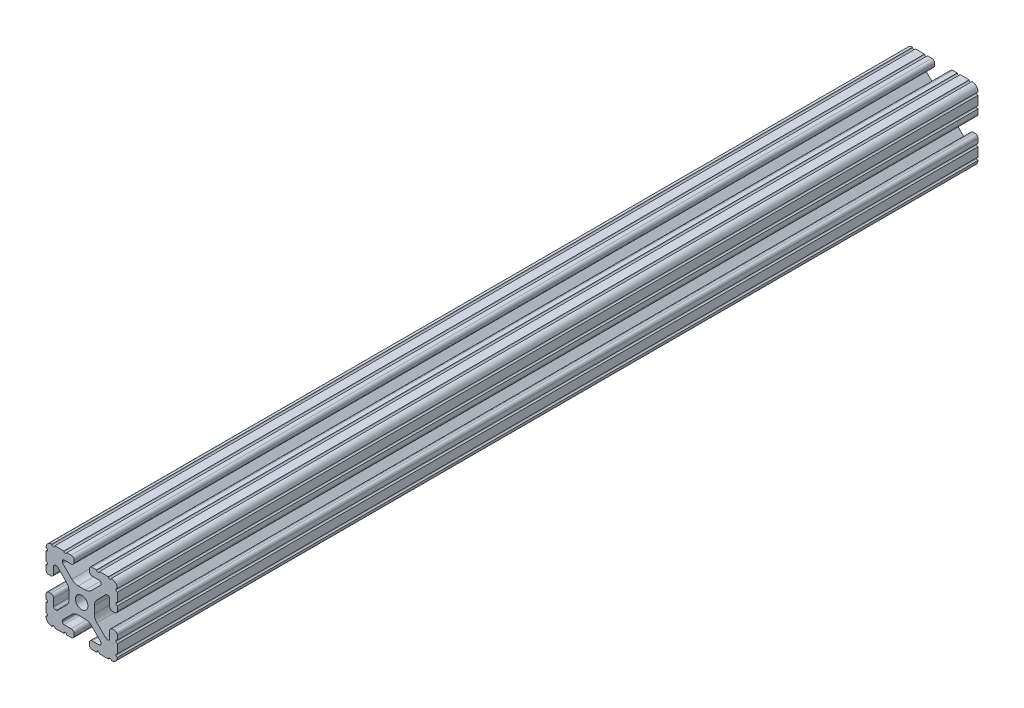
from build123d import *

# Parameters (mm, degrees)
SKETCH1_R      = 3.3274
EXTRUDE1_DEPTH = 459.74


with BuildPart() as part:
    # Sketch1 → Extrude1 (new body)
    with BuildSketch(Plane.XY):
        with BuildLine():
            Line((-10.022898969, 12.91475973), (-5.252158105, 8.144007132))
            ThreePointArc((-5.252158105, 8.144007132), (-3.715177372, 7.117027388), (-1.902183975, 6.7564))
            Line((-1.902183975, 6.7564), (1.902183975, 6.7564))
            ThreePointArc((1.902183975, 6.7564), (3.715177372, 7.117027388), (5.252158105, 8.144007132))
            Line((5.252158105, 8.144007132), (10.022898969, 12.91475973))
            ThreePointArc((10.022898969, 12.91475973), (10.218362387, 13.207291992), (10.287, 13.552357131))
            Line((10.287, 13.552357131), (10.287, 14.0843))
            ThreePointArc((10.287, 14.0843), (10.022898185, 14.721898185), (9.3853, 14.986))
            Line((9.3853, 14.986), (5.617617549, 14.986))
            ThreePointArc((5.617617549, 14.986), (4.519044045, 15.441044045), (4.064, 16.539617549))
            Line((4.064, 16.539617549), (4.064, 17.496382451))
            ThreePointArc((4.064, 17.496382451), (4.519044045, 18.594955955), (5.617617549, 19.05))
            Line((5.617617549, 19.05), (7.974178704, 19.05))
            ThreePointArc((7.974178704, 19.05), (8.736178704, 18.288), (9.498178704, 19.05))
            Line((9.498178704, 19.05), (14.327719207, 19.05))
            ThreePointArc((14.327719207, 19.05), (15.087603123, 18.231251131), (15.847487039, 19.05))
            ThreePointArc((15.847487039, 19.05), (18.120176289, 18.120192083), (19.05, 15.847509295))
            ThreePointArc((19.05, 15.847509295), (18.231250992, 15.08762539), (19.05, 14.327741484))
            Line((19.05, 14.327741484), (19.05, 9.496091471))
            ThreePointArc((19.05, 9.496091471), (18.231250992, 8.736207565), (19.05, 7.97632366))
            Line((19.05, 7.97632366), (19.05, 5.617617549))
            ThreePointArc((19.05, 5.617617549), (18.594955955, 4.519044045), (17.496382451, 4.064))
            Line((17.496382451, 4.064), (16.539617549, 4.064))
            ThreePointArc((16.539617549, 4.064), (15.441044045, 4.519044045), (14.986, 5.617617549))
            Line((14.986, 5.617617549), (14.986, 9.385342516))
            ThreePointArc((14.986, 9.385342516), (14.721898185, 10.022940701), (14.0843, 10.287042516))
            Line((14.0843, 10.287042516), (13.516042086, 10.287042516))
            ThreePointArc((13.516042086, 10.287042516), (13.170975923, 10.218404478), (12.878443117, 10.022939917))
            Line((12.878443117, 10.022939917), (8.14758008, 5.292065243))
            ThreePointArc((8.14758008, 5.292065243), (7.117955879, 3.751120653), (6.7564, 1.933453584))
            Line((6.7564, 1.933453584), (6.7564, -1.933453584))
            ThreePointArc((6.7564, -1.933453584), (7.117955879, -3.751120653), (8.14758008, -5.292065243))
            Line((8.14758008, -5.292065243), (12.878443117, -10.022939917))
            ThreePointArc((12.878443117, -10.022939917), (13.170975923, -10.218404478), (13.516042086, -10.287042516))
            Line((13.516042086, -10.287042516), (14.0843, -10.287042516))
            ThreePointArc((14.0843, -10.287042516), (14.721898185, -10.022940701), (14.986, -9.385342516))
            Line((14.986, -9.385342516), (14.986, -5.617617549))
            ThreePointArc((14.986, -5.617617549), (15.441044045, -4.519044045), (16.539617549, -4.064))
            Line((16.539617549, -4.064), (17.496382451, -4.064))
            ThreePointArc((17.496382451, -4.064), (18.594955955, -4.519044045), (19.05, -5.617617549))
            Line((19.05, -5.617617549), (19.05, -7.976318491))
            ThreePointArc((19.05, -7.976318491), (18.231250992, -8.736202396), (19.05, -9.496086302))
            Line((19.05, -9.496086302), (19.05, -14.32774291))
            ThreePointArc((19.05, -14.32774291), (18.231250992, -15.087626816), (19.05, -15.847510721))
            ThreePointArc((19.05, -15.847510721), (18.120175716, -18.120192644), (15.847486868, -19.05))
            ThreePointArc((15.847486868, -19.05), (15.087602952, -18.231251131), (14.327719036, -19.05))
            Line((14.327719036, -19.05), (9.496062448, -19.05))
            ThreePointArc((9.496062448, -19.05), (8.736178532, -18.231251131), (7.976294616, -19.05))
            Line((7.976294616, -19.05), (5.617617549, -19.05))
            ThreePointArc((5.617617549, -19.05), (4.519044045, -18.594955955), (4.064, -17.496382451))
            Line((4.064, -17.496382451), (4.064, -16.539617549))
            ThreePointArc((4.064, -16.539617549), (4.519044045, -15.441044045), (5.617617549, -14.986))
            Line((5.617617549, -14.986), (9.3853, -14.986))
            ThreePointArc((9.3853, -14.986), (10.022898185, -14.721898185), (10.287, -14.0843))
            Line((10.287, -14.0843), (10.287, -13.552357131))
            ThreePointArc((10.287, -13.552357131), (10.218362387, -13.207291992), (10.022898969, -12.91475973))
            Line((10.022898969, -12.91475973), (5.252158105, -8.144007132))
            ThreePointArc((5.252158105, -8.144007132), (3.715177372, -7.117027388), (1.902183975, -6.7564))
            Line((1.902183975, -6.7564), (-1.902183975, -6.7564))
            ThreePointArc((-1.902183975, -6.7564), (-3.715177372, -7.117027388), (-5.252158105, -8.144007132))
            Line((-5.252158105, -8.144007132), (-10.022898969, -12.91475973))
            ThreePointArc((-10.022898969, -12.91475973), (-10.218362387, -13.207291992), (-10.287, -13.552357131))
            Line((-10.287, -13.552357131), (-10.287, -14.0843))
            ThreePointArc((-10.287, -14.0843), (-10.022898185, -14.721898185), (-9.3853, -14.986))
            Line((-9.3853, -14.986), (-5.617617549, -14.986))
            ThreePointArc((-5.617617549, -14.986), (-4.519044045, -15.441044045), (-4.064, -16.539617549))
            Line((-4.064, -16.539617549), (-4.064, -17.496382451))
            ThreePointArc((-4.064, -17.496382451), (-4.519044045, -18.594955955), (-5.617617549, -19.05))
            Line((-5.617617549, -19.05), (-7.976294616, -19.05))
            ThreePointArc((-7.976294616, -19.05), (-8.736178532, -18.231251131), (-9.496062448, -19.05))
            Line((-9.496062448, -19.05), (-14.327719036, -19.05))
            ThreePointArc((-14.327719036, -19.05), (-15.087602952, -18.231251131), (-15.847486868, -19.05))
            ThreePointArc((-15.847486868, -19.05), (-18.120175716, -18.120192644), (-19.05, -15.847510721))
            ThreePointArc((-19.05, -15.847510721), (-18.231250992, -15.087626816), (-19.05, -14.32774291))
            Line((-19.05, -14.32774291), (-19.05, -9.496086302))
            ThreePointArc((-19.05, -9.496086302), (-18.231250992, -8.736202396), (-19.05, -7.976318491))
            Line((-19.05, -7.976318491), (-19.05, -5.617617549))
            ThreePointArc((-19.05, -5.617617549), (-18.594955955, -4.519044045), (-17.496382451, -4.064))
            Line((-17.496382451, -4.064), (-16.539617549, -4.064))
            ThreePointArc((-16.539617549, -4.064), (-15.441044045, -4.519044045), (-14.986, -5.617617549))
            Line((-14.986, -5.617617549), (-14.986, -9.385342516))
            ThreePointArc((-14.986, -9.385342516), (-14.721898185, -10.022940701), (-14.0843, -10.287042516))
            Line((-14.0843, -10.287042516), (-13.516042086, -10.287042516))
            ThreePointArc((-13.516042086, -10.287042516), (-13.170975923, -10.218404478), (-12.878443117, -10.022939917))
            Line((-12.878443117, -10.022939917), (-8.14758008, -5.292065243))
            ThreePointArc((-8.14758008, -5.292065243), (-7.117955879, -3.751120653), (-6.7564, -1.933453584))
            Line((-6.7564, -1.933453584), (-6.7564, 1.933453584))
            ThreePointArc((-6.7564, 1.933453584), (-7.117955879, 3.751120653), (-8.14758008, 5.292065243))
            Line((-8.14758008, 5.292065243), (-12.878443117, 10.022939917))
            ThreePointArc((-12.878443117, 10.022939917), (-13.170975923, 10.218404478), (-13.516042086, 10.287042516))
            Line((-13.516042086, 10.287042516), (-14.0843, 10.287042516))
            ThreePointArc((-14.0843, 10.287042516), (-14.721898185, 10.022940701), (-14.986, 9.385342516))
            Line((-14.986, 9.385342516), (-14.986, 5.617617549))
            ThreePointArc((-14.986, 5.617617549), (-15.441044045, 4.519044045), (-16.539617549, 4.064))
            Line((-16.539617549, 4.064), (-17.496382451, 4.064))
            ThreePointArc((-17.496382451, 4.064), (-18.594955955, 4.519044045), (-19.05, 5.617617549))
            Line((-19.05, 5.617617549), (-19.05, 7.97632366))
            ThreePointArc((-19.05, 7.97632366), (-18.231250992, 8.736207565), (-19.05, 9.496091471))
            Line((-19.05, 9.496091471), (-19.05, 14.327741484))
            ThreePointArc((-19.05, 14.327741484), (-18.231250992, 15.08762539), (-19.05, 15.847509295))
            ThreePointArc((-19.05, 15.847509295), (-18.120176289, 18.120192083), (-15.847487039, 19.05))
            ThreePointArc((-15.847487039, 19.05), (-15.087603123, 18.231251131), (-14.327719207, 19.05))
            Line((-14.327719207, 19.05), (-9.498178704, 19.05))
            ThreePointArc((-9.498178704, 19.05), (-8.736178704, 18.288), (-7.974178704, 19.05))
            Line((-7.974178704, 19.05), (-5.617617549, 19.05))
            ThreePointArc((-5.617617549, 19.05), (-4.519044045, 18.594955955), (-4.064, 17.496382451))
            Line((-4.064, 17.496382451), (-4.064, 16.539617549))
            ThreePointArc((-4.064, 16.539617549), (-4.519044045, 15.441044045), (-5.617617549, 14.986))
            Line((-5.617617549, 14.986), (-9.3853, 14.986))
            ThreePointArc((-9.3853, 14.986), (-10.022898185, 14.721898185), (-10.287, 14.0843))
            Line((-10.287, 14.0843), (-10.287, 13.552357131))
            ThreePointArc((-10.287, 13.552357131), (-10.218362387, 13.207291992), (-10.022898969, 12.91475973))
        make_face()
        Circle(SKETCH1_R, mode=Mode.SUBTRACT)
    extrude(amount=-EXTRUDE1_DEPTH)


solid = part.part
